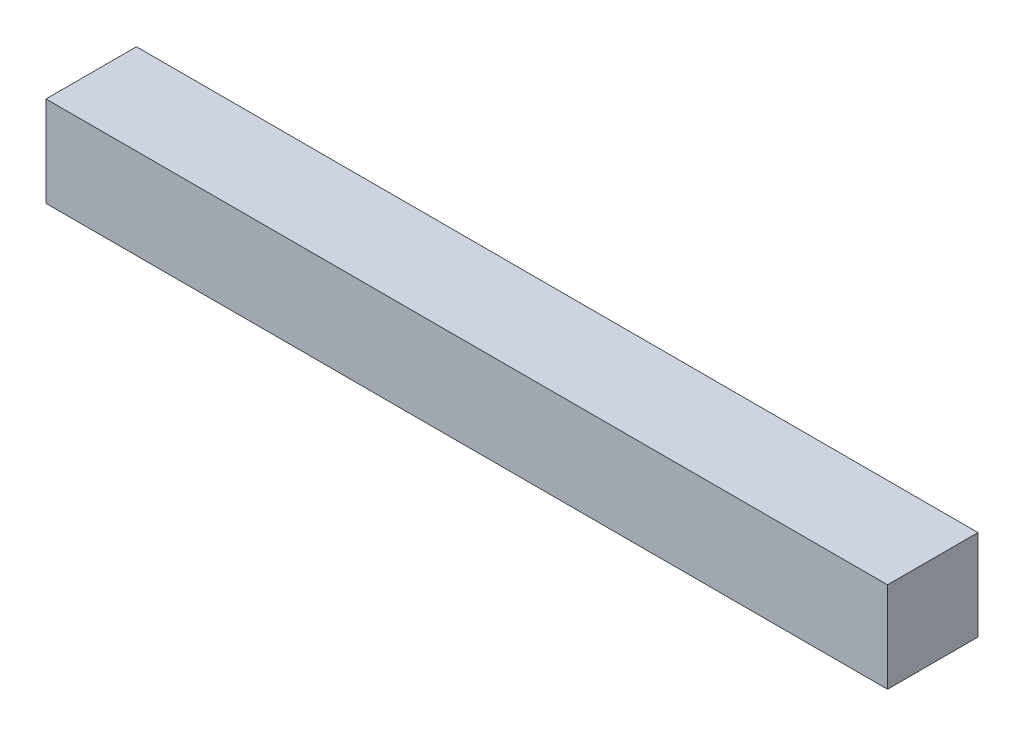
from build123d import *

# Parameters (mm, degrees)
SKETCH_1_W        = 2000
SKETCH_1_H        = 215
EXTRUDE_304_DEPTH = 215


with BuildPart() as part:
    # 草图1 → Extrude 304 (new body)
    with BuildSketch(Plane.XY):
        with Locations((1000, 107.5)):
            Rectangle(SKETCH_1_W, SKETCH_1_H)
    extrude(amount=EXTRUDE_304_DEPTH)


solid = part.part
